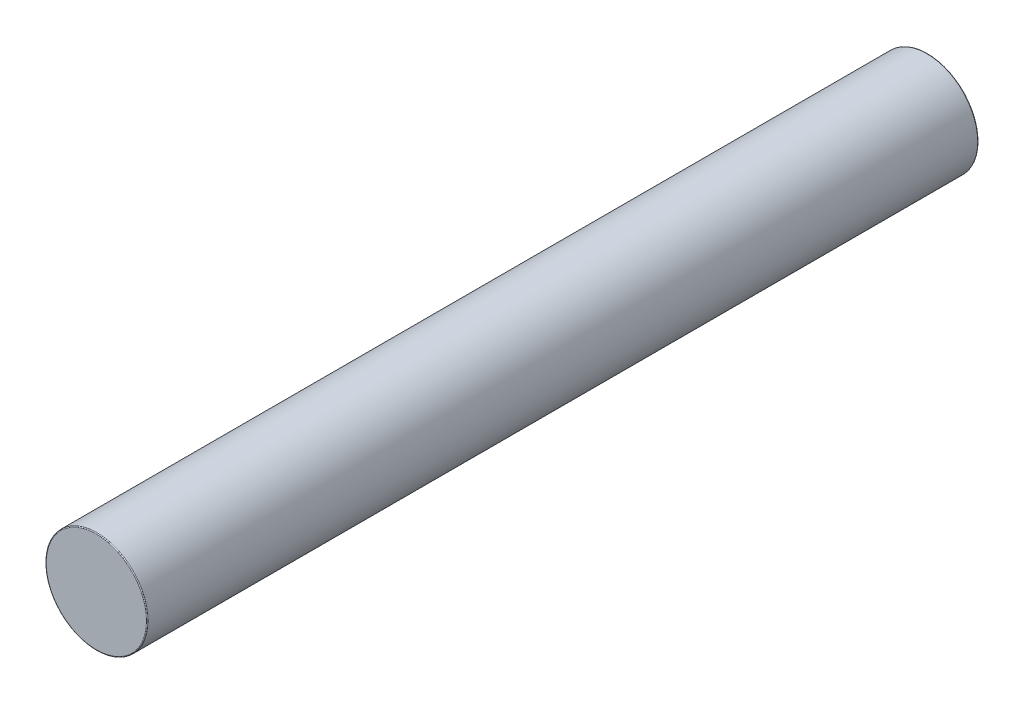
from build123d import *

# Parameters (mm, degrees)
CROQUIS1_R              = 1.225
SALIENTE_EXTRUIR1_DEPTH = 20
REDONDEO1_R             = 0.02


with BuildPart() as part:
    # Croquis1 → Saliente-Extruir1 (new body)
    with BuildSketch(Plane.XY):
        Circle(CROQUIS1_R)
    extrude(amount=SALIENTE_EXTRUIR1_DEPTH)

    # Redondeo1
    redondeo1_edges = [part.edges().sort_by_distance(p)[0] for p in [
        (-1.225, 0, 0),
        (-1.225, 0, 20),
    ]]
    fillet(redondeo1_edges, radius=REDONDEO1_R)


solid = part.part
